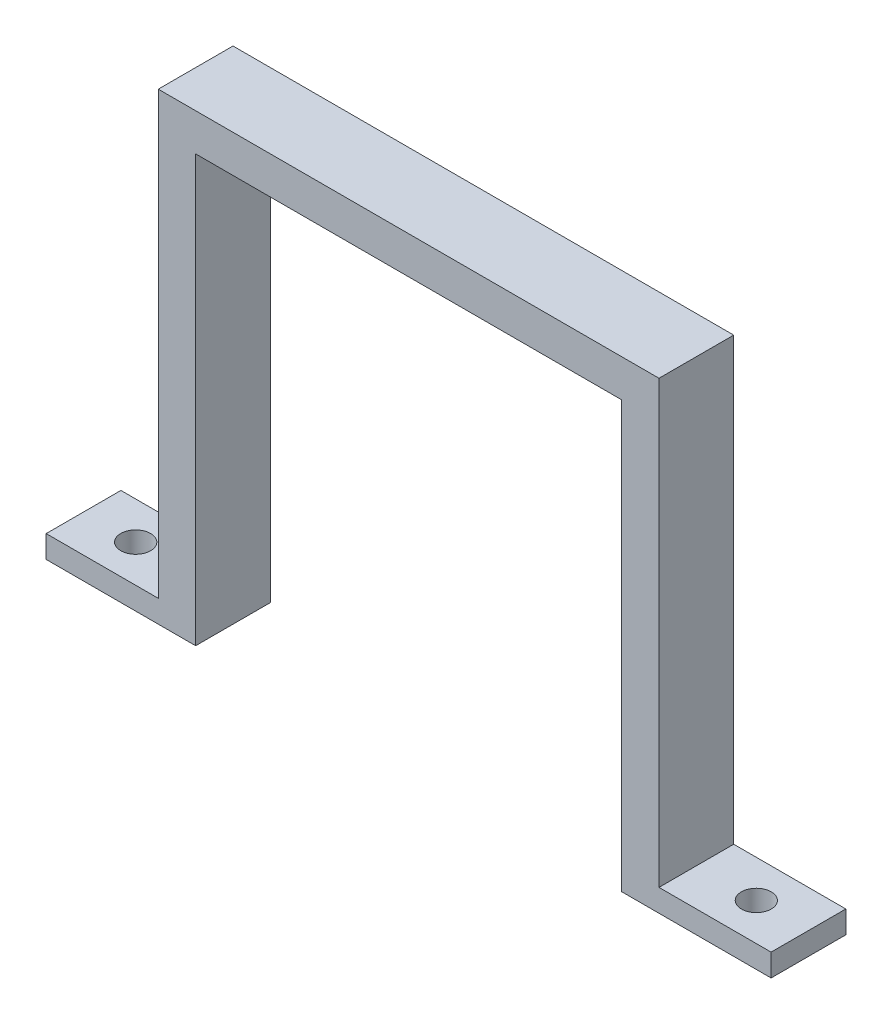
from build123d import *

# Parameters (mm, degrees)
BOSS_EXTRUDE1_DEPTH = 10
SKETCH4_R           = 2
CUT_EXTRUDE2_DEPTH  = 10


with BuildPart() as part:
    # Sketch1 → Boss-Extrude1 (new body)
    with BuildSketch(Plane.XY):
        Polygon((33.476154754, 62), (-33.476154754, 62), (-33.5, 62), (-33.5, 3), (-48.5, 3), (-48.5, 0), (-28.5, 0), (-28.5, 57), (28.5, 57), (28.5, 0), (48.5, 0), (48.5, 3), (33.5, 3), (33.5, 62), align=None)
    extrude(amount=BOSS_EXTRUDE1_DEPTH)

    # Sketch4 → Cut-Extrude2 (cut)
    with BuildSketch(Plane(origin=(0, 0, 0), x_dir=(1, 0, 0), z_dir=(0, 1, 0))):
        with Locations((-41.522360656, -5)):
            Circle(SKETCH4_R)
        with Locations((41.522360656, -5)):
            Circle(SKETCH4_R)
    extrude(amount=CUT_EXTRUDE2_DEPTH, mode=Mode.SUBTRACT)


solid = part.part
